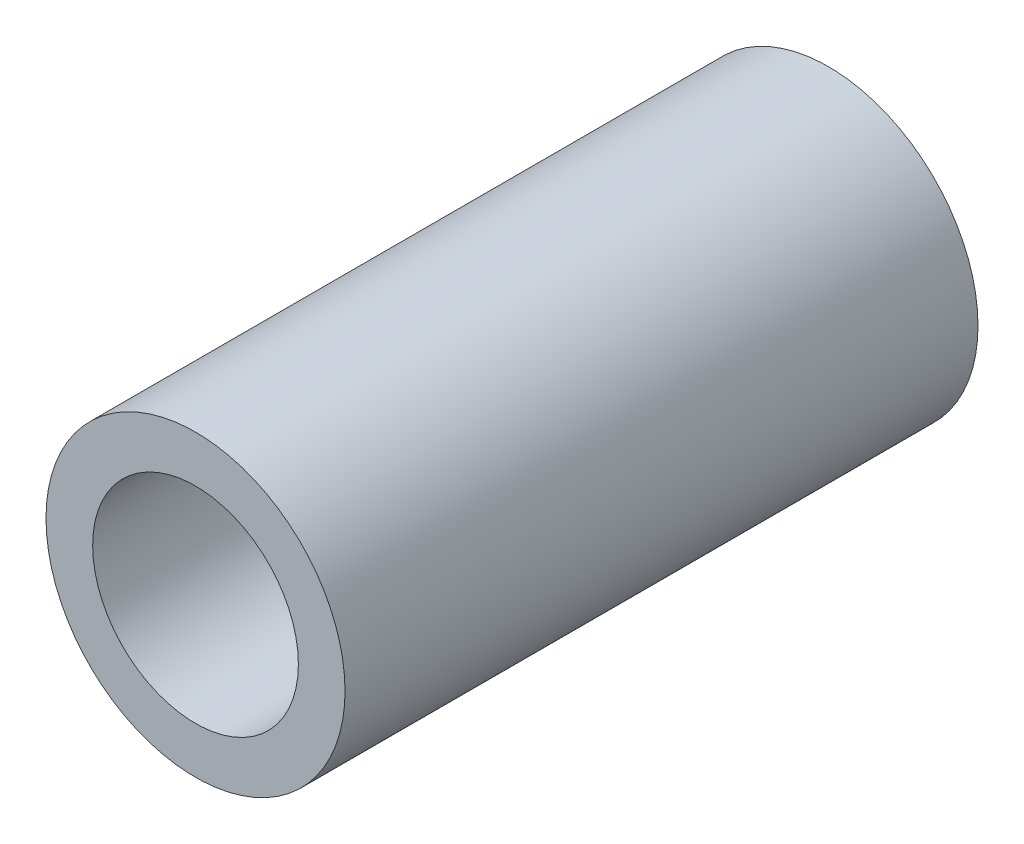
from build123d import *

# Parameters (mm, degrees)
SKETCH1_R           = 6
SKETCH1_R_2         = 4.12770308
BOSS_EXTRUDE1_DEPTH = 12.7


with BuildPart() as part:
    # Sketch1 → Boss-Extrude1 (new, symmetric)
    with BuildSketch(Plane.XY):
        Circle(SKETCH1_R)
        Circle(SKETCH1_R_2, mode=Mode.SUBTRACT)
    extrude(amount=BOSS_EXTRUDE1_DEPTH, both=True)


solid = part.part
